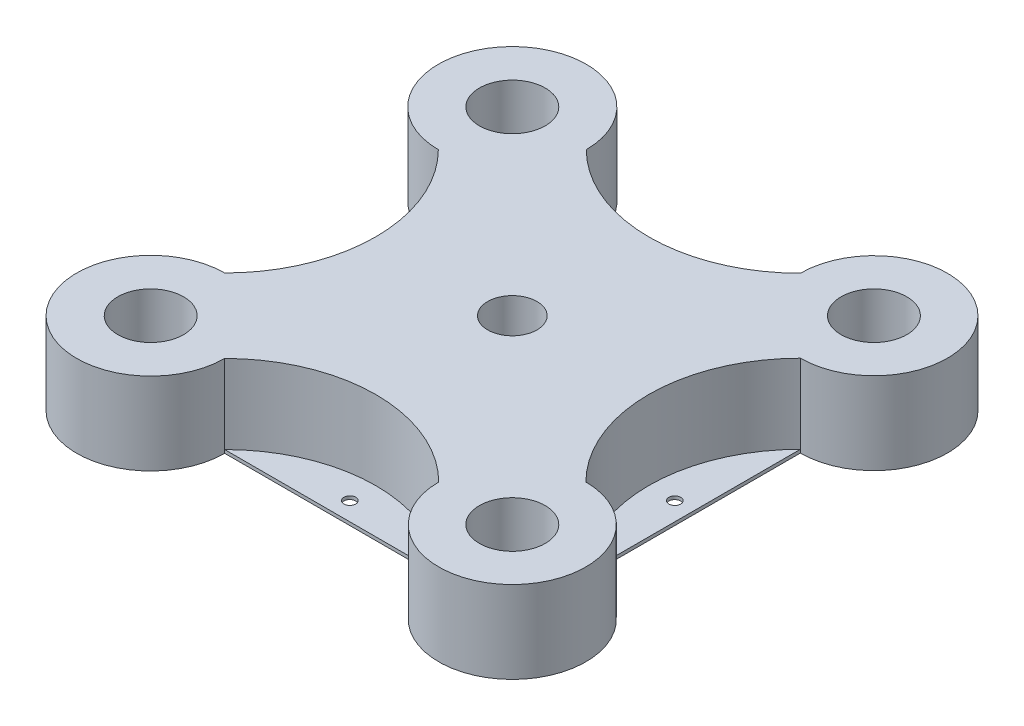
from build123d import *

# Parameters (mm, degrees)
IZIM1_R                     = 75
IZIM1_R_2                   = 100
Y_KSEKLIK_EKSTR_ZYON3_DEPTH = 250
KES_EKSTR_ZYON2_DEPTH       = 240
IZIM4_R                     = 18
KES_EKSTR_ZYON3_DEPTH       = 240
DAIRESEL_KAPLAMA1_COUNT     = 4


with BuildPart() as part:
    # Çizim1 → Yükseklik-Ekstrüzyon3 (new body)
    with BuildSketch(Plane(origin=(0, 0, 0), x_dir=(1, 0, 0), z_dir=(0, 1, 0))):
        with BuildLine():
            Line((326.203305187, 550), (-325, 550))
            ThreePointArc((-325, 550), (-709.099025767, 709.099025767), (-550, 325))
            Line((-550, 325), (-550, -324.872993427))
            ThreePointArc((-550, -324.872993427), (-709.188832976, -709.188832976), (-324.872993427, -550))
            Line((-324.872993427, -550), (326.203305187, -550))
            ThreePointArc((326.203305187, -550), (708.248160509, -708.248160509), (550, -326.203305187))
            Line((550, -326.203305187), (550, 326.203305187))
            ThreePointArc((550, 326.203305187), (708.248160509, 708.248160509), (326.203305187, 550))
        make_face()
        with Locations(Location((0, 0, 0), (0, 0, 270))):
            Circle(IZIM1_R, mode=Mode.SUBTRACT)
        with Locations(Location((-550, 550, 0), (0, 0, 270))):
            Circle(IZIM1_R_2, mode=Mode.SUBTRACT)
        with Locations(Location((-550, -550, 0), (0, 0, 270))):
            Circle(IZIM1_R_2, mode=Mode.SUBTRACT)
        with Locations(Location((550, 550, 0), (0, 0, 270))):
            Circle(IZIM1_R_2, mode=Mode.SUBTRACT)
        with Locations(Location((550, -550, 0), (0, 0, 270))):
            Circle(IZIM1_R_2, mode=Mode.SUBTRACT)
    extrude(amount=Y_KSEKLIK_EKSTR_ZYON3_DEPTH)

    # Çizim2 → Kes-Ekstrüzyon2 (cut)
    with BuildSketch(Plane(origin=(0, 250, 0), x_dir=(1, 0, 0), z_dir=(0, 1, 0))):
        with BuildLine():
            Line((-550, 325), (-550, -324.872993427))
            ThreePointArc((-550, -324.872993427), (-415.406896151, 0.063503286), (-550, 325))
        make_face()
        with BuildLine():
            Line((-324.872993427, -550), (326.203305187, -550))
            ThreePointArc((326.203305187, -550), (0.66515588, -415.157683487), (-324.872993427, -550))
        make_face()
        with BuildLine():
            Line((-325, 550), (326.203305187, 550))
            ThreePointArc((326.203305187, 550), (0.601652594, 415.131379565), (-325, 550))
        make_face()
        with BuildLine():
            Line((550, 326.203305187), (550, -326.203305187))
            ThreePointArc((550, -326.203305187), (414.882166901, 0), (550, 326.203305187))
        make_face()
    extrude(amount=-KES_EKSTR_ZYON2_DEPTH, mode=Mode.SUBTRACT)

    # Çizim4 → Kes-Ekstrüzyon3 (cut)
    with BuildSketch(Plane(origin=(0, 10, 0), x_dir=(1, 0, 0), z_dir=(0, 1, 0))):
        with Locations(Location((-494.284737224, 0.063503286, 0), (0, 0, 270))):
            Circle(IZIM4_R)
    kes_ekstr_zyon3 = extrude(amount=-KES_EKSTR_ZYON3_DEPTH, mode=Mode.SUBTRACT)

    # Dairesel Kaplama1: Kes-Ekstrüzyon3 ×4 about axis
    dairesel_kaplama1_axis = Axis((0, 0, 0), (0, 1, 0))
    for i in range(1, DAIRESEL_KAPLAMA1_COUNT):
        add(kes_ekstr_zyon3.rotate(dairesel_kaplama1_axis, i * 360 / DAIRESEL_KAPLAMA1_COUNT), mode=Mode.SUBTRACT)


solid = part.part
